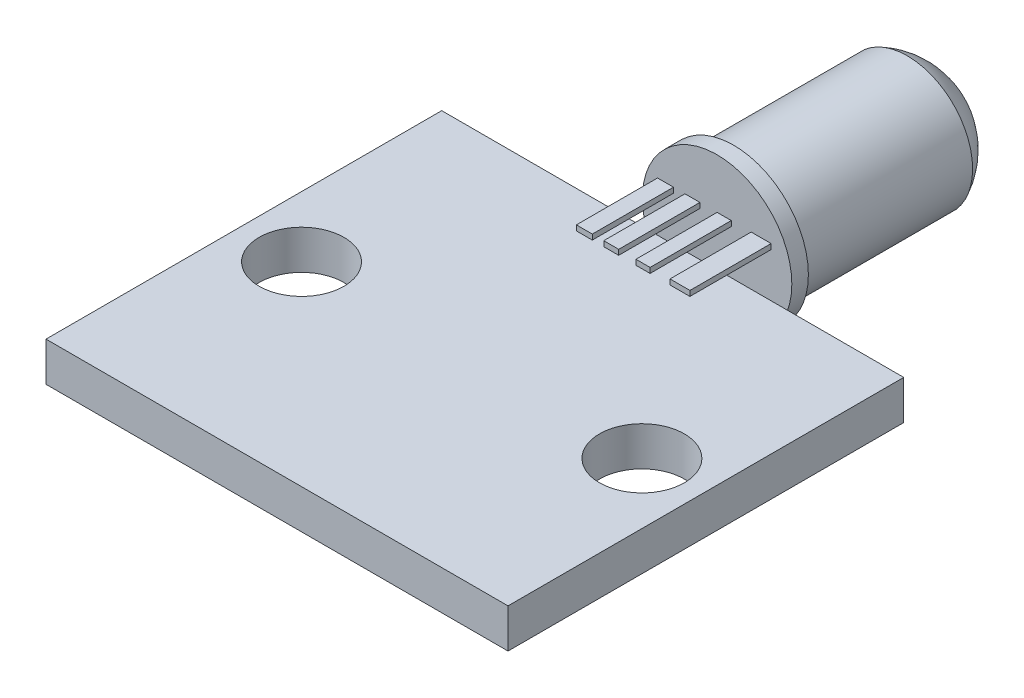
from build123d import *

# Parameters (mm, degrees)
SKETCH1_W           = 17.7
SKETCH1_H           = 15.16
SKETCH1_R           = 1.625
BOSS_EXTRUDE1_DEPTH = 0.75
SKETCH3_W           = 0.610582996
SKETCH3_H           = 3.110461755
SKETCH3_W_2         = 0.572421558
SKETCH3_W_3         = 0.542718384
SKETCH3_W_4         = 0.763228744
BOSS_EXTRUDE2_DEPTH = 0.2


with BuildPart() as part:
    # Sketch1 → Boss-Extrude1 (new, symmetric)
    with BuildSketch(Plane(origin=(0, 0, 0), x_dir=(1, 0, 0), z_dir=(0, 1, 0))):
        Rectangle(SKETCH1_W, SKETCH1_H)
        with Locations(Location((-6.52, -0.12, 0), (0, 0, 270))):
            Circle(SKETCH1_R, mode=Mode.SUBTRACT)
        with Locations(Location((6.52, -0.12, 0), (0, 0, 270))):
            Circle(SKETCH1_R, mode=Mode.SUBTRACT)
    extrude(amount=BOSS_EXTRUDE1_DEPTH, both=True)



with BuildPart() as body_2:
    # Sketch2 → Revolve1 (revolve)
    with BuildSketch(Plane(origin=(0, 0, 0), x_dir=(1, 0, 0), z_dir=(0, 1, 0)), mode=Mode.PRIVATE) as revolve1_sk:
        with BuildLine():
            Line((0, 9.28), (0, 18.13))
            ThreePointArc((0, 18.13), (-1.473784577, 17.707559711), (-2.499995, 16.568529884))
            Line((-2.499995, 16.568529884), (-2.499995, 9.914637604))
            Line((-2.499995, 9.914637604), (-2.862499587, 9.914637604))
            Line((-2.862499587, 9.914637604), (-2.862499587, 9.28))
            Line((-2.862499587, 9.28), (0, 9.28))
        make_face()
    revolve(revolve1_sk.sketch.rotate(Axis((0, 0, 0), (0, 0, -1)), 180), axis=Axis((0, 0, 0), (0, 0, -1)))


with BuildPart() as part_1:
    add(part.part)

    add(body_2.part)  # Boss-Extrude2 merges body 2
    # Sketch3 → Boss-Extrude2 (add)
    with BuildSketch(Plane(origin=(0, 0.75, 0), x_dir=(1, 0, 0), z_dir=(0, 1, 0))):
        with Locations((-1.975936472, 7.724769123)):
            Rectangle(SKETCH3_W, SKETCH3_H)
        with Locations((-0.945577667, 7.724769123)):
            Rectangle(SKETCH3_W_2, SKETCH3_H)
        with Locations((0.271359192, 7.724769123)):
            Rectangle(SKETCH3_W_3, SKETCH3_H)
        with Locations((1.6875615, 7.724769123)):
            Rectangle(SKETCH3_W_4, SKETCH3_H)
    extrude(amount=BOSS_EXTRUDE2_DEPTH)


solid = part_1.part
